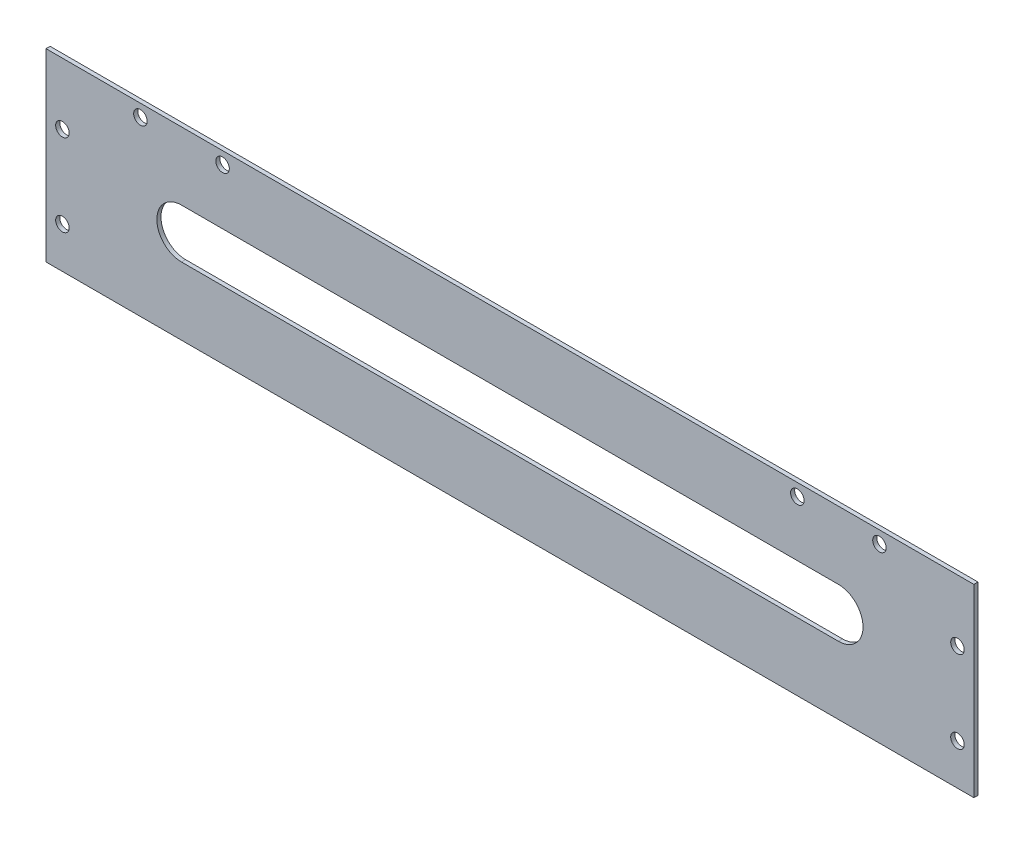
from build123d import *

# Parameters (mm, degrees)
SKETCH_1_W          = 226
SKETCH_1_H          = 45
EXTRUDE_1_DEPTH     = 1
SKETCH_2_R          = 1.65
CUT_EXTRUDE_1_DEPTH = 116.222610628
CUT_EXTRUDE_2_DEPTH = 10
SKETCH_4_R          = 1.65
CUT_EXTRUDE_3_DEPTH = 116.222610628


with BuildPart() as part:
    # 草图1 → 凸台-拉伸1 (new body)
    with BuildSketch(Plane.XY):
        Rectangle(SKETCH_1_W, SKETCH_1_H)
    extrude(amount=EXTRUDE_1_DEPTH)

    # 草图2 → 切除-拉伸1 (cut, through all)
    with BuildSketch(Plane.XY.offset(1)):
        with Locations((90, 19.5)):
            Circle(SKETCH_2_R)
        with Locations((70, 19.5)):
            Circle(SKETCH_2_R)
        with Locations(Location((-70, 19.5, 0), (0, 0, 180))):
            Circle(SKETCH_2_R)
        with Locations(Location((-90, 19.5, 0), (0, 0, 180))):
            Circle(SKETCH_2_R)
    extrude(amount=-CUT_EXTRUDE_1_DEPTH, mode=Mode.SUBTRACT)

    # 草图3 → 切除-拉伸2 (cut)
    with BuildSketch(Plane.XY.offset(1)):
        with BuildLine():
            Line((-80, 6), (80, 6))
            ThreePointArc((80, 6), (86, 0), (80, -6))
            Line((80, -6), (-80, -6))
            ThreePointArc((-80, -6), (-86, 0), (-80, 6))
        make_face()
    extrude(amount=-CUT_EXTRUDE_2_DEPTH, mode=Mode.SUBTRACT)

    # 草图4 → 切除-拉伸3 (cut, through all)
    with BuildSketch(Plane.XY.offset(1)):
        with Locations((109, 7.5)):
            Circle(SKETCH_4_R)
        with Locations((109, -12.5)):
            Circle(SKETCH_4_R)
        with Locations(Location((-109, -12.5, 0), (0, 0, 180))):
            Circle(SKETCH_4_R)
        with Locations(Location((-109, 7.5, 0), (0, 0, 180))):
            Circle(SKETCH_4_R)
    extrude(amount=-CUT_EXTRUDE_3_DEPTH, mode=Mode.SUBTRACT)


solid = part.part
